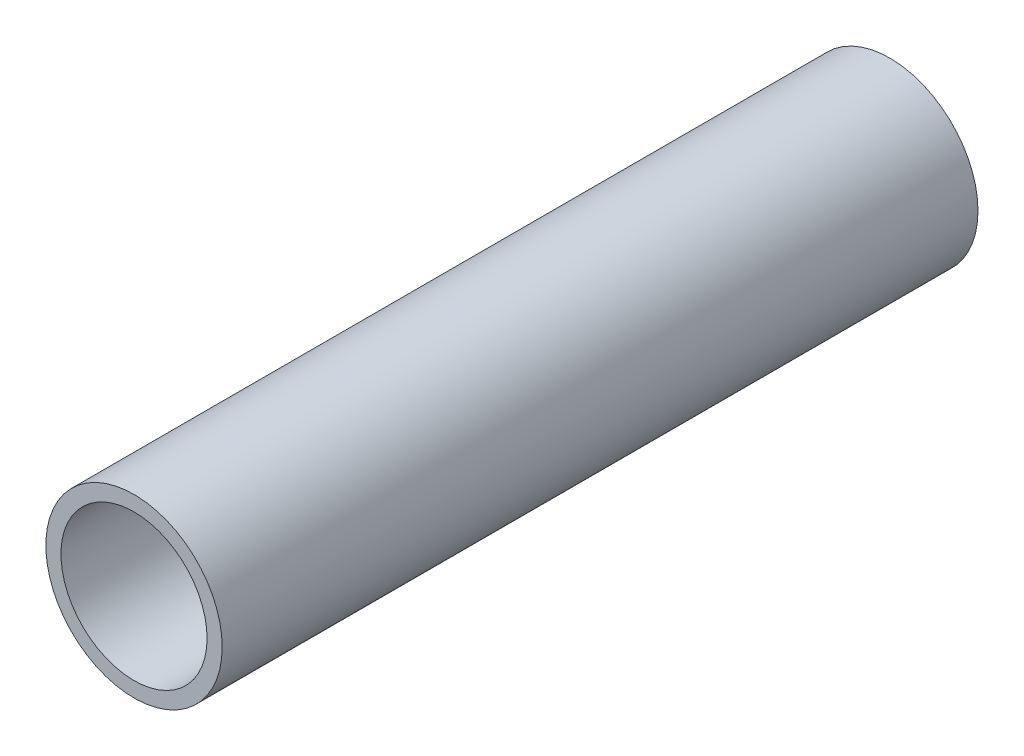
from build123d import *

# Parameters (mm, degrees)
SKETCH_1_R      = 1.75
SKETCH_1_R_2    = 1.45
EXTRUDE_1_DEPTH = 15


with BuildPart() as part:
    # 草图1 → 凸台-拉伸1 (new body)
    with BuildSketch(Plane.XY):
        Circle(SKETCH_1_R)
        Circle(SKETCH_1_R_2, mode=Mode.SUBTRACT)
    extrude(amount=EXTRUDE_1_DEPTH)


solid = part.part
